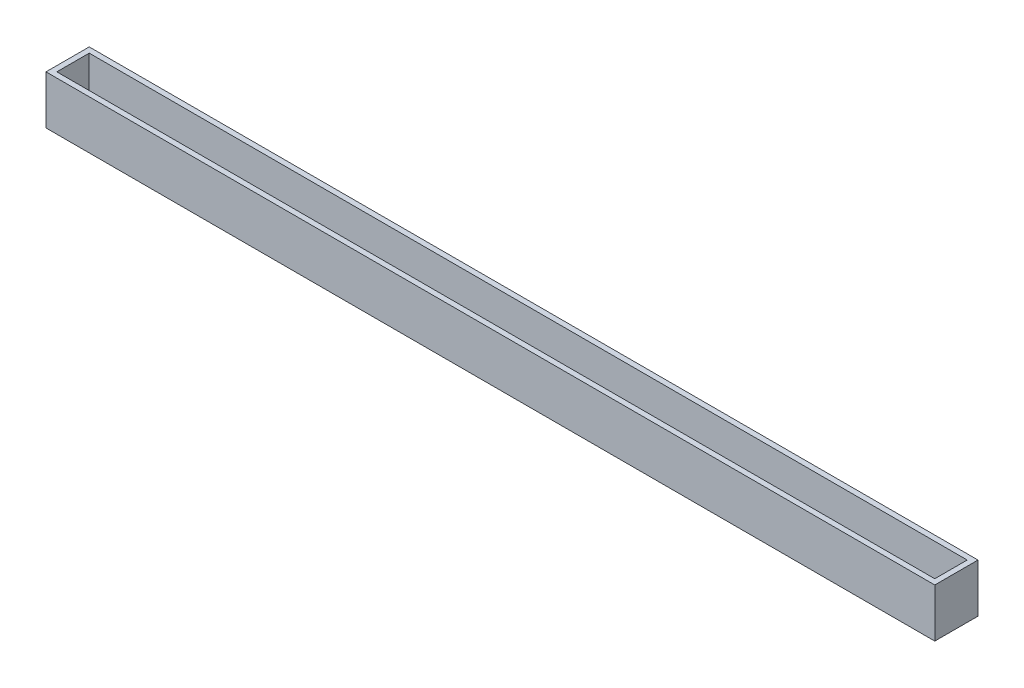
from build123d import *

# Parameters (mm, degrees)
SKETCH_1_W      = 3290
SKETCH_1_H      = 160
EXTRUDE_1_DEPTH = 180
SHELL_1_T       = -20


with BuildPart() as part:
    # Эскиз1 → Бобышка-Вытянуть1 (new body)
    with BuildSketch(Plane(origin=(0, 0, 0), x_dir=(1, 0, 0), z_dir=(0, 1, 0))):
        Rectangle(SKETCH_1_W, SKETCH_1_H)
    extrude(amount=EXTRUDE_1_DEPTH)

    # Оболочка1
    shell_1_openings = [part.faces().sort_by_distance(p)[0] for p in [
        (0, 180, 0),
    ]]
    offset(amount=SHELL_1_T, openings=shell_1_openings, kind=Kind.INTERSECTION)


solid = part.part
